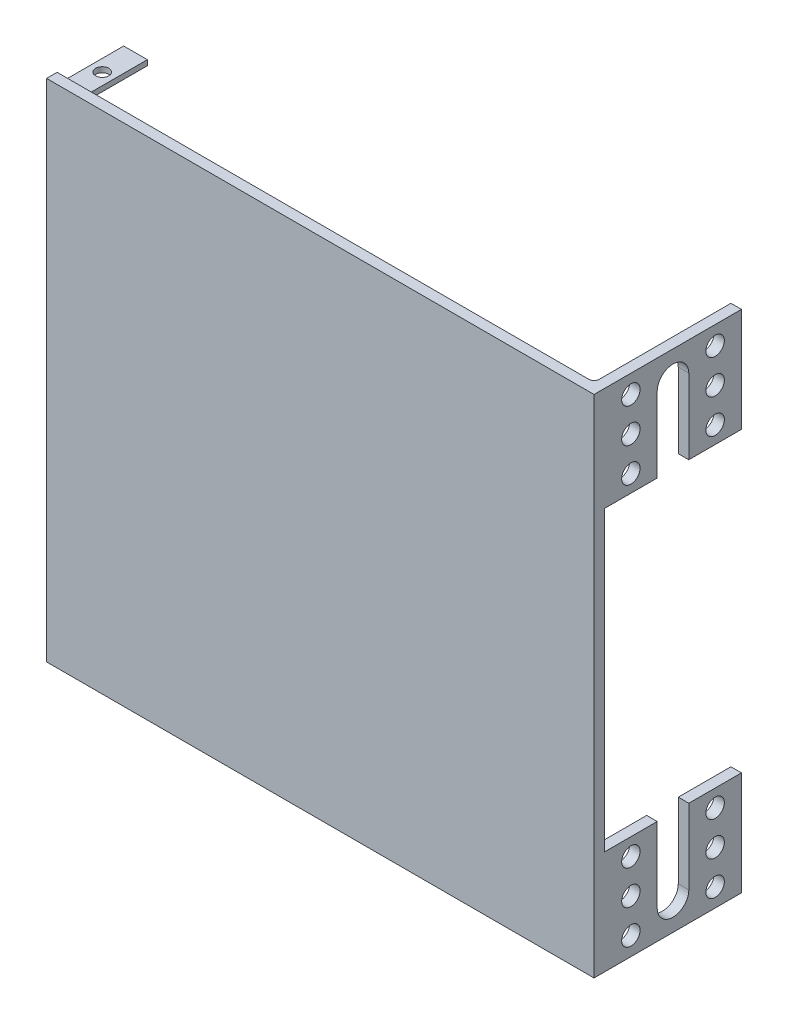
from build123d import *

# Parameters (mm, degrees)
SKETCH_1_W          = 104
SKETCH_1_H          = 96
EXTRUDE_1_DEPTH     = 2
SKETCH_2_W          = 2
SKETCH_2_H          = 96
EXTRUDE_2_DEPTH     = 26
SKETCH_3_R          = 1.75
CUT_EXTRUDE_1_DEPTH = 116.689238912
SKETCH_4_W          = 26
SKETCH_4_H          = 56.5
CUT_EXTRUDE_2_DEPTH = 118.45637488
FILLET_2_R          = 1
SKETCH_5_W          = 6
SKETCH_5_H          = 14.25
CUT_EXTRUDE_3_DEPTH = 118.45637488
SKETCH_6_W          = 4.5
SKETCH_6_H          = 1
EXTRUDE_3_DEPTH     = 12.65
SKETCH_7_R          = 1.25
CUT_EXTRUDE_4_DEPTH = 111.526015037


with BuildPart() as part:
    # 草图1 → 凸台-拉伸1 (new body)
    with BuildSketch(Plane.XY):
        Rectangle(SKETCH_1_W, SKETCH_1_H)
    extrude(amount=EXTRUDE_1_DEPTH)

    # 草图2 → 凸台-拉伸2 (add)
    with BuildSketch(Plane(origin=(0, 0, 0), x_dir=(-1, 0, 0), z_dir=(0, 0, -1))):
        with Locations((-51, 0)):
            Rectangle(SKETCH_2_W, SKETCH_2_H)
    extrude(amount=EXTRUDE_2_DEPTH)

    # 草图3 → 切除-拉伸1 (cut, through all)
    with BuildSketch(Plane.ZY.offset(-50)):
        with Locations((-5, 44.5)):
            Circle(SKETCH_3_R)
        with Locations((-5, 38)):
            Circle(SKETCH_3_R)
        with Locations((-5, 31.5)):
            Circle(SKETCH_3_R)
        with Locations(Location((-21, 31.5, 0), (0, 0, 180))):
            Circle(SKETCH_3_R)
        with Locations(Location((-21, 38, 0), (0, 0, 180))):
            Circle(SKETCH_3_R)
        with Locations(Location((-21, 44.5, 0), (0, 0, 180))):
            Circle(SKETCH_3_R)
        with Locations((-21, -44.5)):
            Circle(SKETCH_3_R)
        with Locations((-21, -38)):
            Circle(SKETCH_3_R)
        with Locations((-21, -31.5)):
            Circle(SKETCH_3_R)
        with Locations(Location((-5, -31.5, 0), (0, 0, 180))):
            Circle(SKETCH_3_R)
        with Locations(Location((-5, -38, 0), (0, 0, 180))):
            Circle(SKETCH_3_R)
        with Locations(Location((-5, -44.5, 0), (0, 0, 180))):
            Circle(SKETCH_3_R)
    extrude(amount=-CUT_EXTRUDE_1_DEPTH, mode=Mode.SUBTRACT)

    # 草图4 → 切除-拉伸2 (cut, through all)
    with BuildSketch(Plane(origin=(52, 0, 0), x_dir=(0, 0, -1), z_dir=(1, 0, 0))):
        with Locations((13, 0)):
            Rectangle(SKETCH_4_W, SKETCH_4_H)
    extrude(amount=-CUT_EXTRUDE_2_DEPTH, mode=Mode.SUBTRACT)

    # 圆角2
    fillet_2_edges = [part.edges().sort_by_distance(p)[0] for p in [
        (50, -38.125, 0),
        (50, 38.125, 0),
    ]]
    fillet(fillet_2_edges, radius=FILLET_2_R)

    # 草图5 → 切除-拉伸3 (cut, through all)
    with BuildSketch(Plane(origin=(52, 0, 0), x_dir=(0, 0, -1), z_dir=(1, 0, 0))):
        with Locations((13, 35.375)):
            Rectangle(SKETCH_5_W, SKETCH_5_H)
        with BuildLine():
            ThreePointArc((10, 42.5), (13, 45.5), (16, 42.5))
            Line((16, 42.5), (10, 42.5))
        make_face()
        with Locations((13, -35.375)):
            Rectangle(SKETCH_5_W, SKETCH_5_H)
        with BuildLine():
            Line((10, -42.5), (16, -42.5))
            ThreePointArc((16, -42.5), (13, -45.5), (10, -42.5))
        make_face()
    extrude(amount=-CUT_EXTRUDE_3_DEPTH, mode=Mode.SUBTRACT)

    # 草图6 → 凸台-拉伸3 (add)
    with BuildSketch(Plane(origin=(0, 0, 0), x_dir=(-1, 0, 0), z_dir=(0, 0, -1))):
        with Locations((49.75, 45.5)):
            Rectangle(SKETCH_6_W, SKETCH_6_H)
    extrude_3 = extrude(amount=EXTRUDE_3_DEPTH)

    # 草图7 → 切除-拉伸4 (cut, through all)
    with BuildSketch(Plane(origin=(0, 46, 0), x_dir=(1, 0, 0), z_dir=(0, 1, 0))):
        with Locations(Location((-49.75, 6.325, 0), (0, 0, 180))):
            Circle(SKETCH_7_R)
    cut_extrude_4 = extrude(amount=-CUT_EXTRUDE_4_DEPTH, mode=Mode.SUBTRACT)

    # 镜向1: 凸台-拉伸3, 切除-拉伸4 across plane
    add(extrude_3.mirror(Plane.ZX))
    add(cut_extrude_4.mirror(Plane.ZX), mode=Mode.SUBTRACT)


solid = part.part
